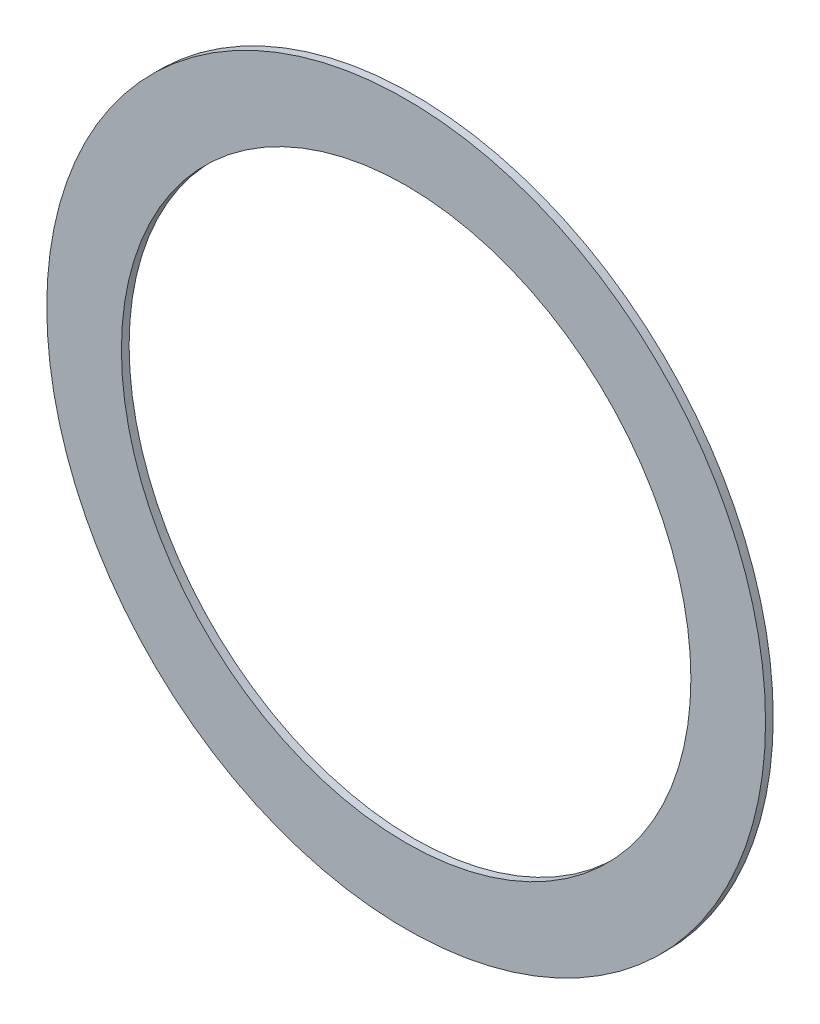
from build123d import *

# Parameters (mm, degrees)
ESQUISSE1_R          = 23.35
ESQUISSE1_R_2        = 18.5
BASE_EXTRUSION_DEPTH = 0.5


with BuildPart() as part:
    # Esquisse1 → Base-Extrusion (new body)
    with BuildSketch(Plane.XY):
        Circle(ESQUISSE1_R)
        Circle(ESQUISSE1_R_2, mode=Mode.SUBTRACT)
    extrude(amount=BASE_EXTRUSION_DEPTH)


solid = part.part
